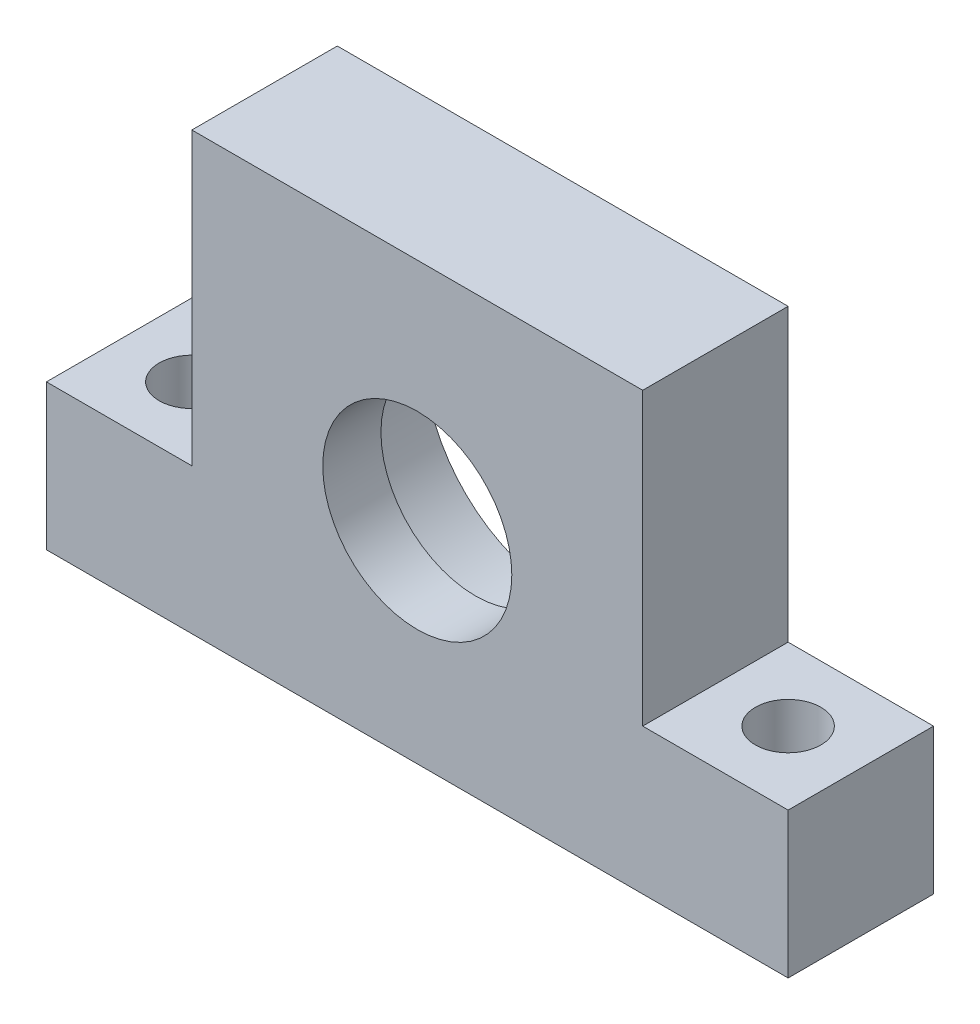
from build123d import *

# Parameters (mm, degrees)
BOSS_EXTRUDE1_DEPTH = 10
SKETCH5_R           = 6.5
CUT_EXTRUDE1_DEPTH  = 10
SKETCH7_R           = 9.5
CUT_EXTRUDE2_DEPTH  = 6
SKETCH8_R           = 2.25
CUT_EXTRUDE3_DEPTH  = 15


with BuildPart() as part:
    # Sketch1 → Boss-Extrude1 (new body)
    with BuildSketch(Plane.XY):
        Polygon((-42.953588015, -13.19658427), (8.046411985, -13.19658427), (8.046411985, -3.19658427), (-1.953588015, -3.19658427), (-1.953588015, 16.80341573), (-32.953588015, 16.80341573), (-32.953588015, -3.19658427), (-42.953588015, -3.19658427), align=None)
    extrude(amount=BOSS_EXTRUDE1_DEPTH)

    # Sketch5 → Cut-Extrude1 (cut)
    with BuildSketch(Plane(origin=(0, 0, 0), x_dir=(-1, 0, 0), z_dir=(0, 0, -1))):
        with Locations((17.453588015, 1.30341573)):
            Circle(SKETCH5_R)
    extrude(amount=-CUT_EXTRUDE1_DEPTH, mode=Mode.SUBTRACT)

    # Sketch7 → Cut-Extrude2 (cut)
    with BuildSketch(Plane(origin=(0, 0, 0), x_dir=(-1, 0, 0), z_dir=(0, 0, -1))):
        with Locations((17.453588015, 1.30341573)):
            Circle(SKETCH7_R)
    extrude(amount=-CUT_EXTRUDE2_DEPTH, mode=Mode.SUBTRACT)

    # Sketch8 → Cut-Extrude3 (cut)
    with BuildSketch(Plane(origin=(0, -3.19658427, 0), x_dir=(1, 0, 0), z_dir=(0, 1, 0))):
        with Locations(Location((3.046411985, -5, 0), (0, 0, 180))):
            Circle(SKETCH8_R)
        with Locations(Location((-37.953588015, -5, 0), (0, 0, 180))):
            Circle(SKETCH8_R)
    extrude(amount=-CUT_EXTRUDE3_DEPTH, mode=Mode.SUBTRACT)


solid = part.part
